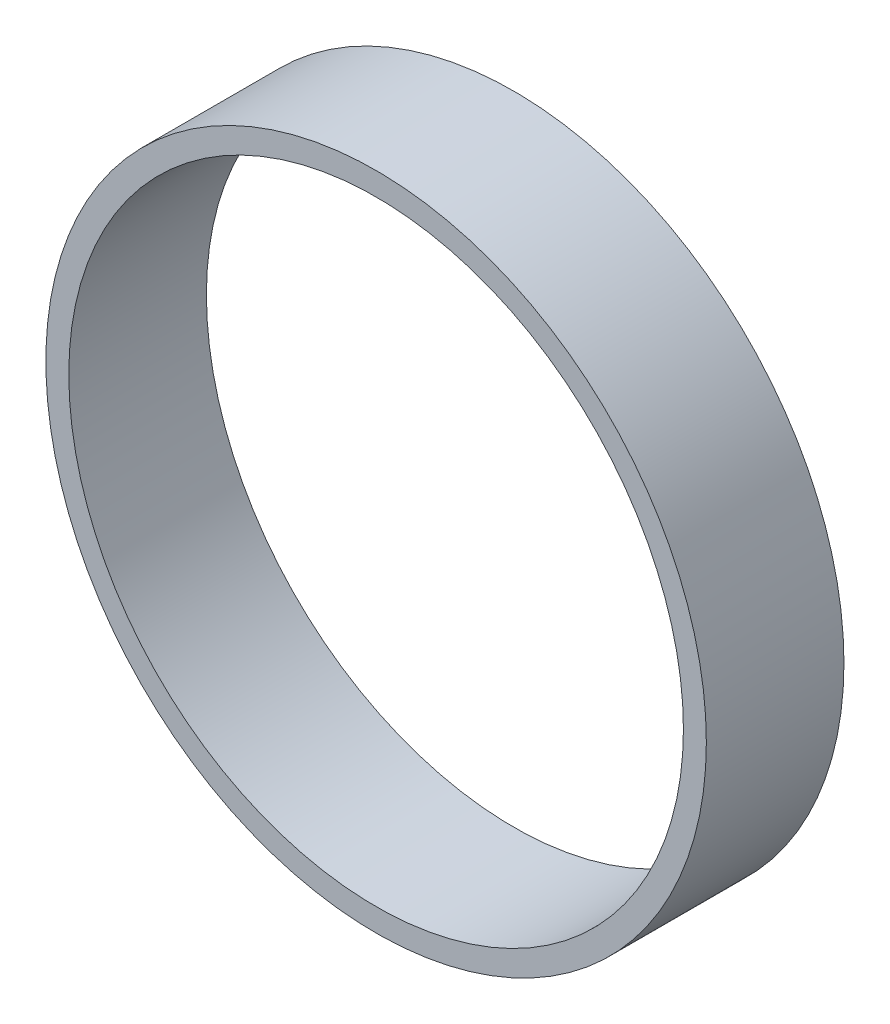
from build123d import *

# Parameters (mm, degrees)
SKETCH1_R           = 72
SKETCH1_R_2         = 67
BOSS_EXTRUDE1_DEPTH = 30


with BuildPart() as part:
    # Sketch1 → Boss-Extrude1 (new body)
    with BuildSketch(Plane.XY):
        Circle(SKETCH1_R)
        Circle(SKETCH1_R_2, mode=Mode.SUBTRACT)
    extrude(amount=BOSS_EXTRUDE1_DEPTH)


solid = part.part
